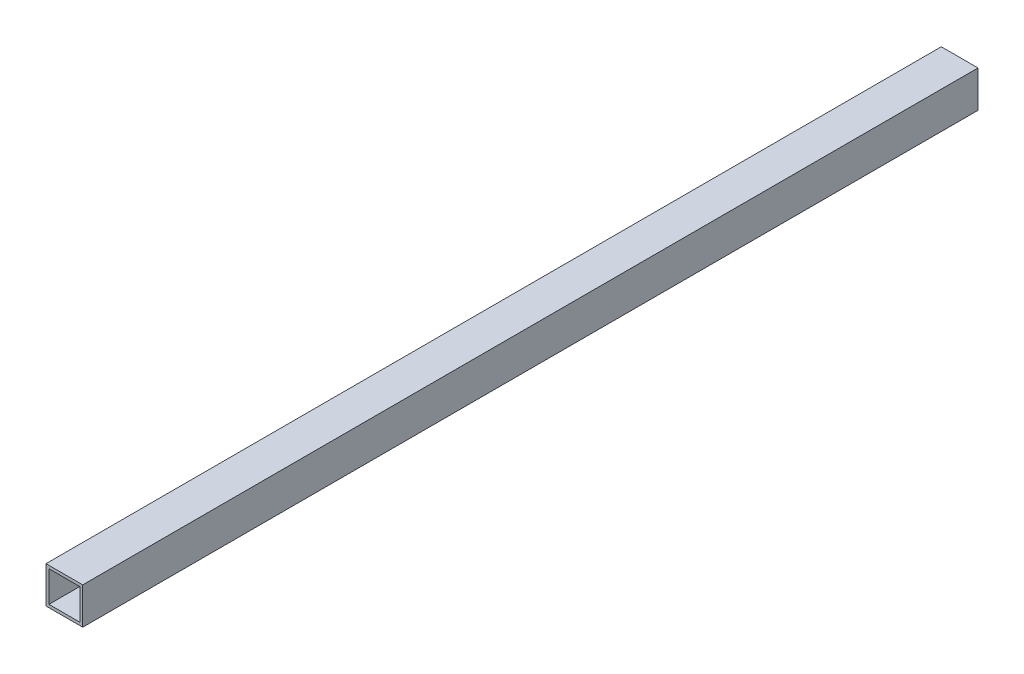
from build123d import *

# Parameters (mm, degrees)
BOSS_EXTRUDE1_DEPTH      = 304.8
BOSS_EXTRUDE1_DEPTH_BACK = 304.8
SKETCH3_W                = 25
SKETCH3_H                = 25
SKETCH3_W_2              = 21
SKETCH3_H_2              = 21


with BuildPart() as part:
    # Sketch3 → Boss-Extrude1 (new, two sides: drawn at the far end of the back side and taken through both)
    with BuildSketch(Plane.XY.offset(-BOSS_EXTRUDE1_DEPTH_BACK)):
        Rectangle(SKETCH3_W, SKETCH3_H)
        Rectangle(SKETCH3_W_2, SKETCH3_H_2, mode=Mode.SUBTRACT)
    extrude(amount=BOSS_EXTRUDE1_DEPTH + BOSS_EXTRUDE1_DEPTH_BACK)


solid = part.part
